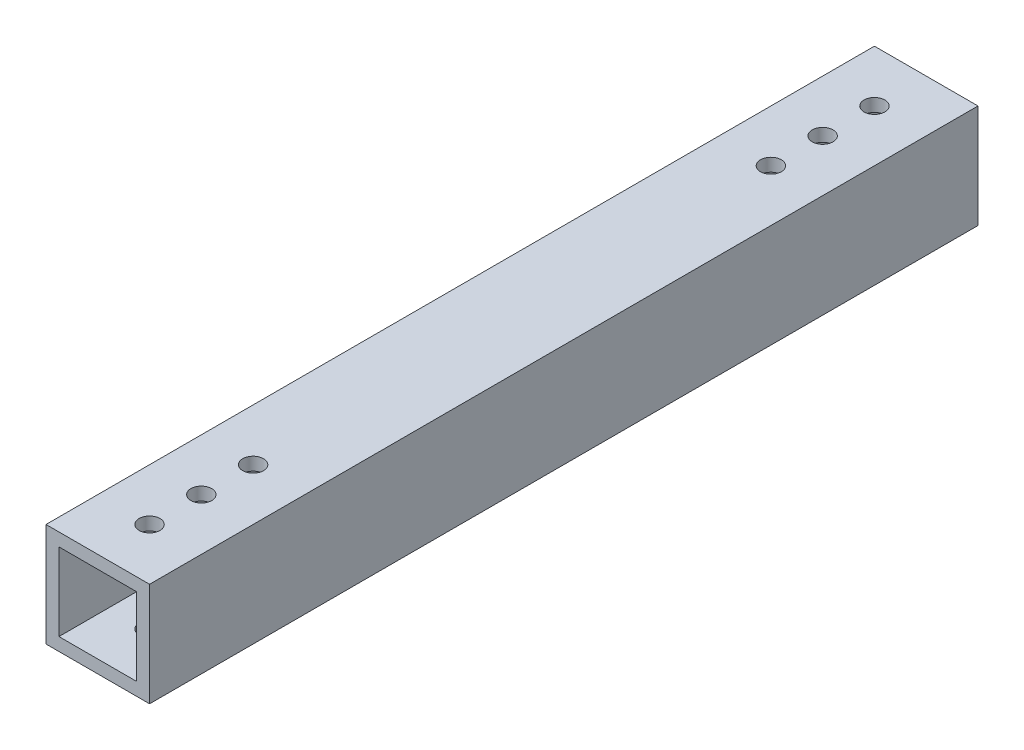
from build123d import *

# Parameters (mm, degrees)
SKETCH1_W              = 25.4
SKETCH1_H              = 25.4
SKETCH1_W_2            = 19.05
SKETCH1_H_2            = 19.05
BOSS_EXTRUDE1_DEPTH    = 203.2
F_10_CLEARANCE_HOLE1_D = 5.1054


with BuildPart() as part:
    # Sketch1 → Boss-Extrude1 (new body)
    with BuildSketch(Plane.XY):
        with Locations((-12.7, 12.7)):
            Rectangle(SKETCH1_W, SKETCH1_H)
        with Locations((-12.7, 12.7)):
            Rectangle(SKETCH1_W_2, SKETCH1_H_2, mode=Mode.SUBTRACT)
    extrude(amount=BOSS_EXTRUDE1_DEPTH)

    # #10 Clearance Hole1 (through all)
    with Locations(Plane(origin=(0, 25.4, 0), x_dir=(1, 0, 0), z_dir=(0, 1, 0))):
        with Locations((-12.7, -165.1), (-12.7, -177.8), (-12.7, -190.5), (-12.7, -12.7), (-12.7, -25.4), (-12.7, -38.1)):
            Hole(F_10_CLEARANCE_HOLE1_D / 2)


solid = part.part
